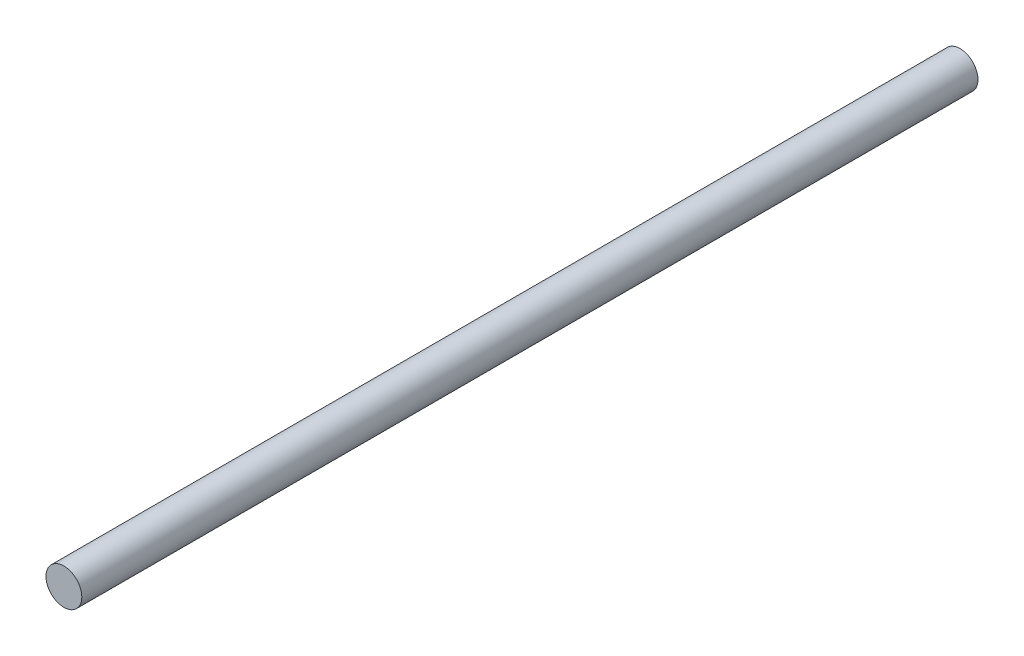
from build123d import *

# Parameters (mm, degrees)
ESQUISSE1_R        = 10
BOSS_EXTRU_1_DEPTH = 500


with BuildPart() as part:
    # Esquisse1 → Boss.-Extru.1 (new body)
    with BuildSketch(Plane.XY):
        Circle(ESQUISSE1_R)
    extrude(amount=BOSS_EXTRU_1_DEPTH)


solid = part.part
